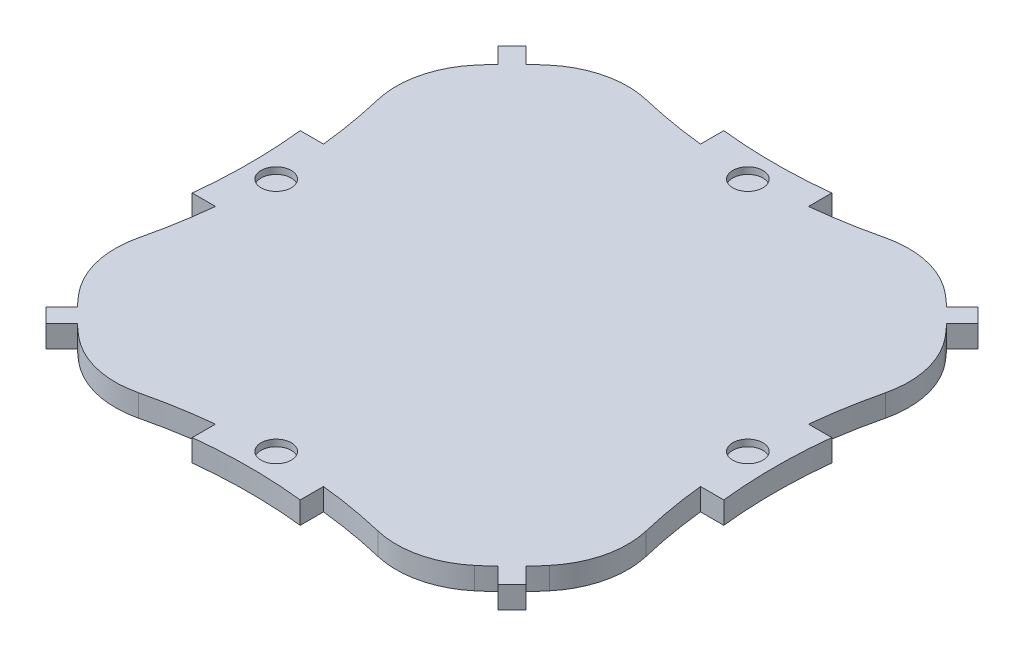
from build123d import *

# Parameters (mm, degrees)
SKETCH1_R                = 35.433
BOSS_EXTRUDE1_DEPTH      = 2.54
SKETCH2_R                = 59.158135963
CUT_EXTRUDE1_DEPTH       = 51.174162454
BOSS_EXTRUDE3_DEPTH      = 2.54
SKETCH4_R                = 1.7399
CUT_EXTRUDE2_DEPTH       = 0.762
FILLET1_R                = 10.287
EXTRUDE_THIN1_DEPTH      = 2.54
CIRPATTERN1_COUNT        = 4
FILLET1_OF_CIRPATTERN1_R = 10.287


with BuildPart() as part:
    # Sketch1 → Boss-Extrude1 (new body)
    with BuildSketch(Plane(origin=(0, 0, 0), x_dir=(1, 0, 0), z_dir=(0, 1, 0))):
        with Locations(Location((0, 0, 0), (0, 0, 270))):
            Circle(SKETCH1_R)
    extrude(amount=BOSS_EXTRUDE1_DEPTH)

    # Sketch2 → Cut-Extrude1 (cut, through all)
    with BuildSketch(Plane(origin=(0, 2.54, 0), x_dir=(1, 0, 0), z_dir=(0, 1, 0))):
        with Locations((0, 86.777928127)):
            Circle(SKETCH2_R)
    cut_extrude1 = extrude(amount=-CUT_EXTRUDE1_DEPTH, mode=Mode.SUBTRACT)

    # Sketch3 → Boss-Extrude3 (add)
    with BuildSketch(Plane(origin=(0, 0, 0), x_dir=(-1, 0, 0), z_dir=(0, -1, 0))):
        with BuildLine():
            Line((6.223, 22.34125112), (-6.223, 22.34125112))
            Line((-6.223, 22.34125112), (-6.223, 30.630597706))
            ThreePointArc((-6.223, 30.630597706), (0, 30.286792164), (6.223, 30.630597706))
            Line((6.223, 30.630597706), (6.223, 22.34125112))
        make_face()
    boss_extrude3 = extrude(amount=-BOSS_EXTRUDE3_DEPTH)

    # Sketch4 → Cut-Extrude2 (cut)
    with BuildSketch(Plane(origin=(0, 2.54, 0), x_dir=(1, 0, 0), z_dir=(0, 1, 0))):
        with Locations(Location((0, 27.178, 0), (0, 0, 270))):
            Circle(SKETCH4_R)
    cut_extrude2 = extrude(amount=-CUT_EXTRUDE2_DEPTH, mode=Mode.SUBTRACT)

    # Fillet1
    fillet1_edges = [part.edges().sort_by_distance(p)[0] for p in [
        (18.104908895, 1.27, -30.458328301),
        (-18.104908895, 1.27, -30.458328301),
    ]]
    fillet(fillet1_edges, radius=FILLET1_R)

    # Sketch5 → Extrude-Thin1 (add)
    with BuildSketch(Plane(origin=(0, 2.54, 0), x_dir=(1, 0, 0), z_dir=(0, 1, 0))):
        Polygon((0.808223051, -0.808223051), (27.659188853, 26.042742751), (26.042742751, 27.659188853), (-0.808223051, 0.808223051), align=None)
    extrude_thin1 = extrude(amount=-EXTRUDE_THIN1_DEPTH)

    # CirPattern1: Cut-Extrude1, Boss-Extrude3, Cut-Extrude2, Extrude-Thin1 ×4 about axis
    cirpattern1_axis = Axis((0, 0, 0), (0, 1, 0))
    add([cut_extrude1.rotate(cirpattern1_axis, i * 360 / CIRPATTERN1_COUNT) for i in range(1, CIRPATTERN1_COUNT)], mode=Mode.SUBTRACT)
    add([boss_extrude3.rotate(cirpattern1_axis, i * 360 / CIRPATTERN1_COUNT) for i in range(1, CIRPATTERN1_COUNT)])
    add([cut_extrude2.rotate(cirpattern1_axis, i * 360 / CIRPATTERN1_COUNT) for i in range(1, CIRPATTERN1_COUNT)], mode=Mode.SUBTRACT)
    add([extrude_thin1.rotate(cirpattern1_axis, i * 360 / CIRPATTERN1_COUNT) for i in range(1, CIRPATTERN1_COUNT)])

    # Fillet1 of CirPattern1
    fillet1_of_cirpattern1_edges = [part.edges().sort_by_distance(p)[0] for p in [
        (-30.458328301, 1.27, -18.104908895),
        (-30.458328301, 1.27, 18.104908895),
        (-18.104908895, 1.27, 30.458328301),
        (18.104908895, 1.27, 30.458328301),
        (30.458328301, 1.27, 18.104908895),
        (30.458328301, 1.27, -18.104908895),
    ]]
    fillet(fillet1_of_cirpattern1_edges, radius=FILLET1_OF_CIRPATTERN1_R)


solid = part.part
